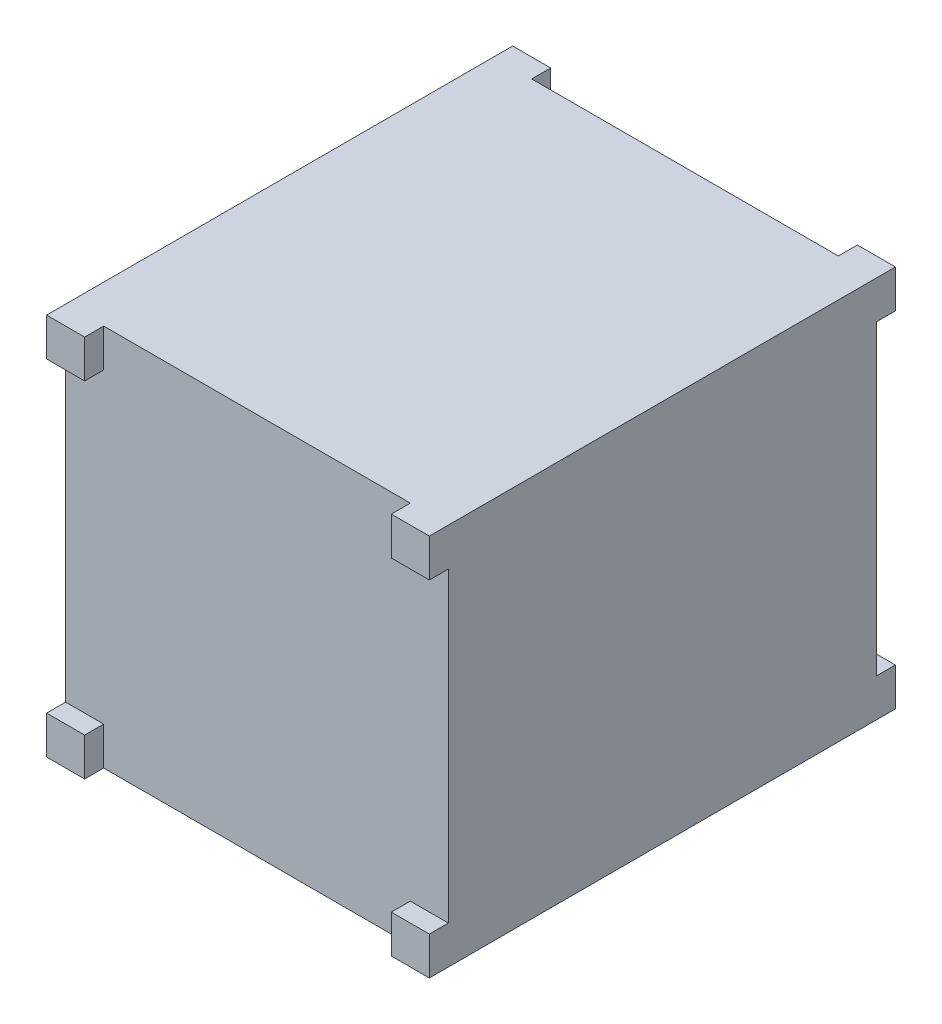
from build123d import *

# Parameters (mm, degrees)
SKETCH1_W           = 100.6
SKETCH1_H           = 100.6
BOSS_EXTRUDE1_DEPTH = 56.25
SKETCH2_W           = 10
SKETCH2_H           = 10
BOSS_EXTRUDE2_DEPTH = 5
SKETCH3_W           = 10
SKETCH3_H           = 10
BOSS_EXTRUDE3_DEPTH = 5


with BuildPart() as part:
    # Sketch1 → Boss-Extrude1 (new, symmetric)
    with BuildSketch(Plane.XY):
        Rectangle(SKETCH1_W, SKETCH1_H)
    extrude(amount=BOSS_EXTRUDE1_DEPTH, both=True)

    # Sketch2 → Boss-Extrude2 (add)
    with BuildSketch(Plane.XY.offset(56.25)):
        with Locations((-45.3, 45.3)):
            Rectangle(SKETCH2_W, SKETCH2_H)
        with Locations((45.3, 45.3)):
            Rectangle(SKETCH2_W, SKETCH2_H)
        with Locations((45.3, -45.3)):
            Rectangle(SKETCH2_W, SKETCH2_H)
        with Locations((-45.3, -45.3)):
            Rectangle(SKETCH2_W, SKETCH2_H)
    extrude(amount=BOSS_EXTRUDE2_DEPTH)

    # Sketch3 → Boss-Extrude3 (add)
    with BuildSketch(Plane(origin=(0, 0, -56.25), x_dir=(-1, 0, 0), z_dir=(0, 0, -1))):
        with Locations((-45.3, 45.3)):
            Rectangle(SKETCH3_W, SKETCH3_H)
        with Locations((45.3, 45.3)):
            Rectangle(SKETCH3_W, SKETCH3_H)
        with Locations((45.3, -45.3)):
            Rectangle(SKETCH3_W, SKETCH3_H)
        with Locations((-45.3, -45.3)):
            Rectangle(SKETCH3_W, SKETCH3_H)
    extrude(amount=BOSS_EXTRUDE3_DEPTH)


solid = part.part
